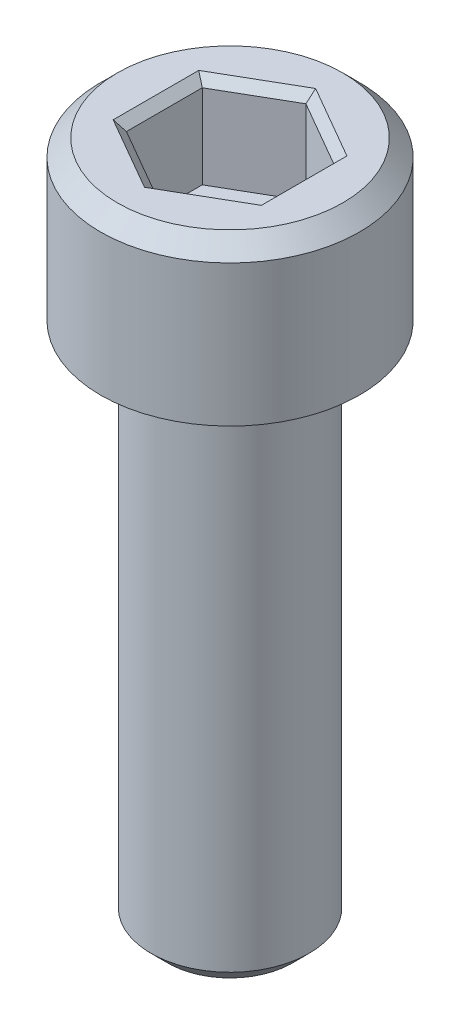
from build123d import *

# Parameters (mm, degrees)
SKETCH1_W           = 3.9116
SKETCH1_H           = 4.7752
SKETCH2_R           = 2.3876
BOSS_EXTRUDE1_DEPTH = 15.875
CUT_EXTRUDE1_DEPTH  = 2.794
CHAMFER1_SIZE       = 0.508
CHAMFER2_SIZE       = 0.254


with BuildPart() as part:
    # Sketch1 → Revolve1 (revolve)
    with BuildSketch(Plane.XY, mode=Mode.PRIVATE) as revolve1_sk:
        with Locations((-1.9558, -2.3876)):
            Rectangle(SKETCH1_W, SKETCH1_H)
    revolve(revolve1_sk.sketch.rotate(Axis((0, -4.7752, 0), (0, 1, 0)), 90), axis=Axis((0, -4.7752, 0), (0, 1, 0)))

    # Sketch2 → Boss-Extrude1 (add)
    with BuildSketch(Plane.XZ.offset(4.7752)):
        with Locations(Location((0, 0, 0), (0, 0, 270))):
            Circle(SKETCH2_R)
    extrude(amount=BOSS_EXTRUDE1_DEPTH)

    # Sketch3 → Cut-Extrude1 (cut)
    with BuildSketch(Plane(origin=(0, 0, 0), x_dir=(-1, 0, 0), z_dir=(0, 1, 0))):
        Polygon((1.984374999, -1.14567944), (1.984374999, 1.14567944), (0, 2.29135888), (-1.984374999, 1.14567944), (-1.984374999, -1.14567944), (0, -2.29135888), align=None)
    extrude(amount=-CUT_EXTRUDE1_DEPTH, mode=Mode.SUBTRACT)

    # Chamfer1
    chamfer1_edges = [part.edges().sort_by_distance(p)[0] for p in [
        (0, 0, -3.9116),
        (0, -20.6502, 2.3876),
    ]]
    chamfer(chamfer1_edges, length=CHAMFER1_SIZE)

    # Chamfer2
    chamfer2_edges = [part.edges().sort_by_distance(p)[0] for p in [
        (-0.9921875, 0, -1.71851916),
        (-1.984374999, 0, 0),
        (-0.9921875, 0, 1.71851916),
        (0.9921875, 0, 1.71851916),
        (1.984374999, 0, 0),
        (0.9921875, 0, -1.71851916),
    ]]
    chamfer(chamfer2_edges, length=CHAMFER2_SIZE)


solid = part.part
